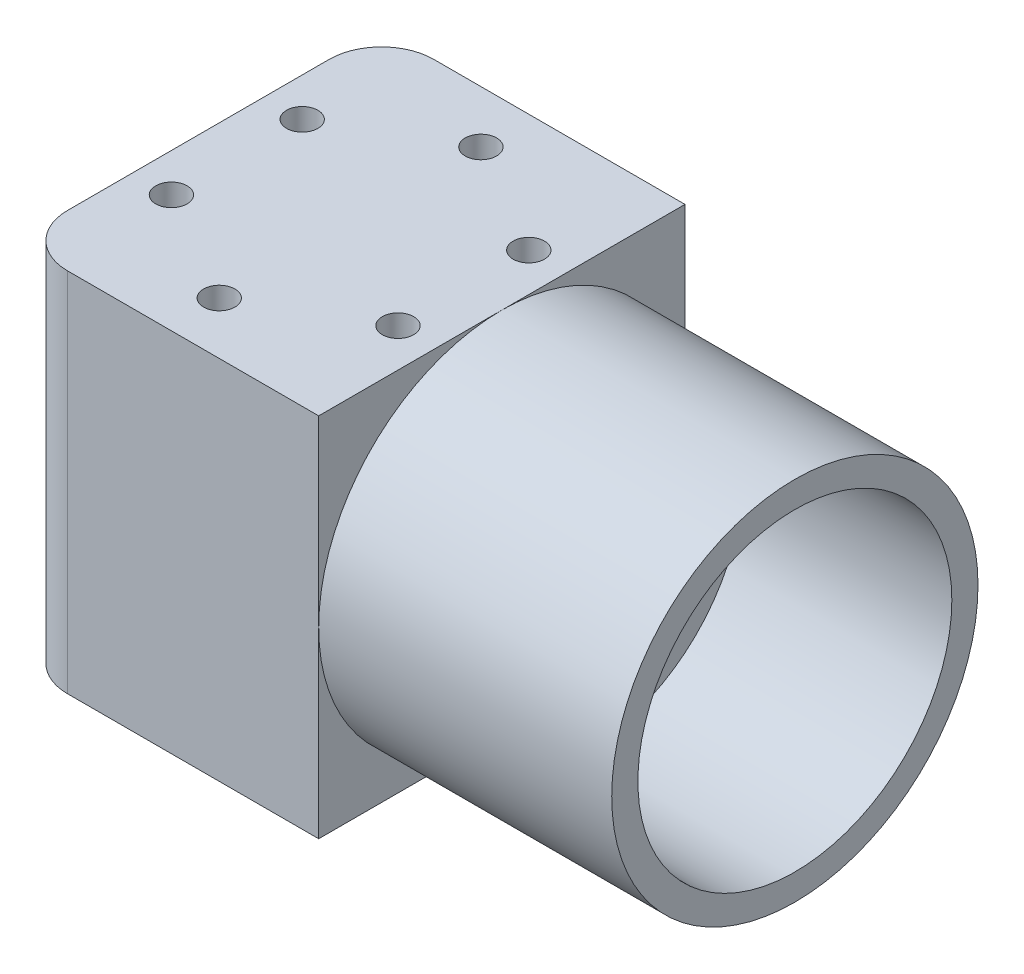
from build123d import *

# Parameters (mm, degrees)
SKETCH1_W           = 29
SKETCH1_H           = 35
BOSS_EXTRUDE1_DEPTH = 17.5
FILLET1_R           = 5
SKETCH2_R           = 17.5
BOSS_EXTRUDE2_DEPTH = 28
SKETCH3_R           = 15
CUT_EXTRUDE1_DEPTH  = 20
CUT_EXTRUDE2_REACH  = 59.771
SKETCH4_R           = 1.5


with BuildPart() as part:
    # Sketch1 → Boss-Extrude1 (new, symmetric)
    with BuildSketch(Plane(origin=(0, 0, 0), x_dir=(1, 0, 0), z_dir=(0, 1, 0))):
        Rectangle(SKETCH1_W, SKETCH1_H)
    extrude(amount=BOSS_EXTRUDE1_DEPTH, both=True)

    # Fillet1
    fillet1_edges = [part.edges().sort_by_distance(p)[0] for p in [
        (-14.5, 0, 17.5),
        (-14.5, 0, -17.5),
    ]]
    fillet(fillet1_edges, radius=FILLET1_R)

    # Sketch2 → Boss-Extrude2 (add)
    with BuildSketch(Plane(origin=(14.5, 0, 0), x_dir=(0, 0, -1), z_dir=(1, 0, 0))):
        Circle(SKETCH2_R)
    extrude(amount=BOSS_EXTRUDE2_DEPTH)

    # Sketch3 → Cut-Extrude1 (cut)
    with BuildSketch(Plane(origin=(42.5, 0, 0), x_dir=(0, 0, -1), z_dir=(1, 0, 0))):
        Circle(SKETCH3_R)
    extrude(amount=-CUT_EXTRUDE1_DEPTH, mode=Mode.SUBTRACT)

    # Sketch4 → Cut-Extrude2 (cut, up to next)
    with BuildSketch(Plane.XZ.offset(17.5), mode=Mode.PRIVATE) as cut_extrude2_sk1:
        with Locations(Location((0, 12.5, 0), (0, 0, 270))):
            Circle(SKETCH4_R)
    cut_extrude2_tool1 = extrude(cut_extrude2_sk1.sketch, amount=-CUT_EXTRUDE2_REACH, mode=Mode.PRIVATE) & part.part
    # Sketch4 → Cut-Extrude2 (cut, up to next)
    with BuildSketch(Plane.XZ.offset(17.5), mode=Mode.PRIVATE) as cut_extrude2_sk2:
        with Locations(Location((10.825317547, 6.25, 0), (0, 0, 270))):
            Circle(SKETCH4_R)
    cut_extrude2_tool2 = extrude(cut_extrude2_sk2.sketch, amount=-CUT_EXTRUDE2_REACH, mode=Mode.PRIVATE) & part.part
    # Sketch4 → Cut-Extrude2 (cut, up to next)
    with BuildSketch(Plane.XZ.offset(17.5), mode=Mode.PRIVATE) as cut_extrude2_sk3:
        with Locations(Location((10.825317547, -6.25, 0), (0, 0, 270))):
            Circle(SKETCH4_R)
    cut_extrude2_tool3 = extrude(cut_extrude2_sk3.sketch, amount=-CUT_EXTRUDE2_REACH, mode=Mode.PRIVATE) & part.part
    # Sketch4 → Cut-Extrude2 (cut, up to next)
    with BuildSketch(Plane.XZ.offset(17.5), mode=Mode.PRIVATE) as cut_extrude2_sk4:
        with Locations(Location((0, -12.5, 0), (0, 0, 270))):
            Circle(SKETCH4_R)
    cut_extrude2_tool4 = extrude(cut_extrude2_sk4.sketch, amount=-CUT_EXTRUDE2_REACH, mode=Mode.PRIVATE) & part.part
    # Sketch4 → Cut-Extrude2 (cut, up to next)
    with BuildSketch(Plane.XZ.offset(17.5), mode=Mode.PRIVATE) as cut_extrude2_sk5:
        with Locations(Location((-10.825317547, -6.25, 0), (0, 0, 270))):
            Circle(SKETCH4_R)
    cut_extrude2_tool5 = extrude(cut_extrude2_sk5.sketch, amount=-CUT_EXTRUDE2_REACH, mode=Mode.PRIVATE) & part.part
    # Sketch4 → Cut-Extrude2 (cut, up to next)
    with BuildSketch(Plane.XZ.offset(17.5), mode=Mode.PRIVATE) as cut_extrude2_sk6:
        with Locations(Location((-10.825317547, 6.25, 0), (0, 0, 270))):
            Circle(SKETCH4_R)
    cut_extrude2_tool6 = extrude(cut_extrude2_sk6.sketch, amount=-CUT_EXTRUDE2_REACH, mode=Mode.PRIVATE) & part.part
    add(cut_extrude2_tool1.solids().sort_by_distance((0, -17.5, 12.5))[0], mode=Mode.SUBTRACT)
    add(cut_extrude2_tool2.solids().sort_by_distance((10.825318, -17.5, 6.25))[0], mode=Mode.SUBTRACT)
    add(cut_extrude2_tool3.solids().sort_by_distance((10.825318, -17.5, -6.25))[0], mode=Mode.SUBTRACT)
    add(cut_extrude2_tool4.solids().sort_by_distance((0, -17.5, -12.5))[0], mode=Mode.SUBTRACT)
    add(cut_extrude2_tool5.solids().sort_by_distance((-10.825318, -17.5, -6.25))[0], mode=Mode.SUBTRACT)
    add(cut_extrude2_tool6.solids().sort_by_distance((-10.825318, -17.5, 6.25))[0], mode=Mode.SUBTRACT)


solid = part.part
